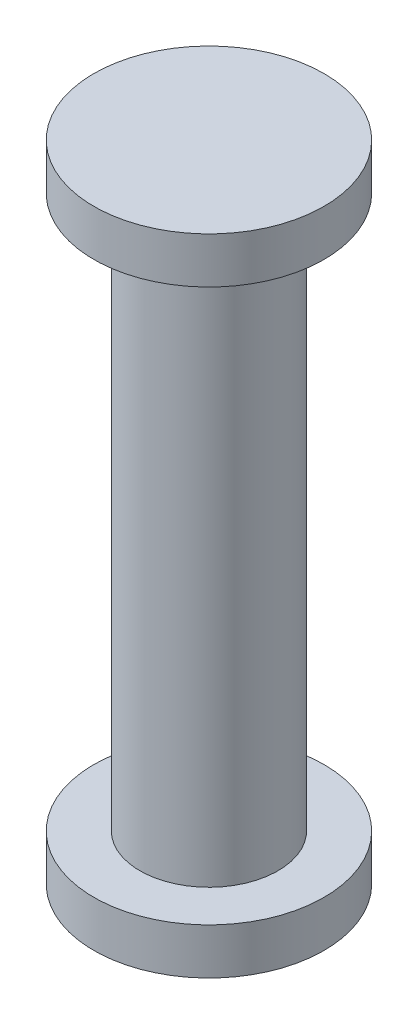
from build123d import *


with BuildPart() as part:
    # Sketch1 → Revolve1 (revolve)
    with BuildSketch(Plane.XY, mode=Mode.PRIVATE) as revolve1_sk:
        Polygon((0, 0), (0, 14), (-2.5, 14), (-2.5, 13), (-1.5, 13), (-1.5, 1), (-2.5, 1), (-2.5, 0), align=None)
    revolve(revolve1_sk.sketch.rotate(Axis((0, 0, 0), (0, 1, 0)), 270), axis=Axis((0, 0, 0), (0, 1, 0)))


solid = part.part
